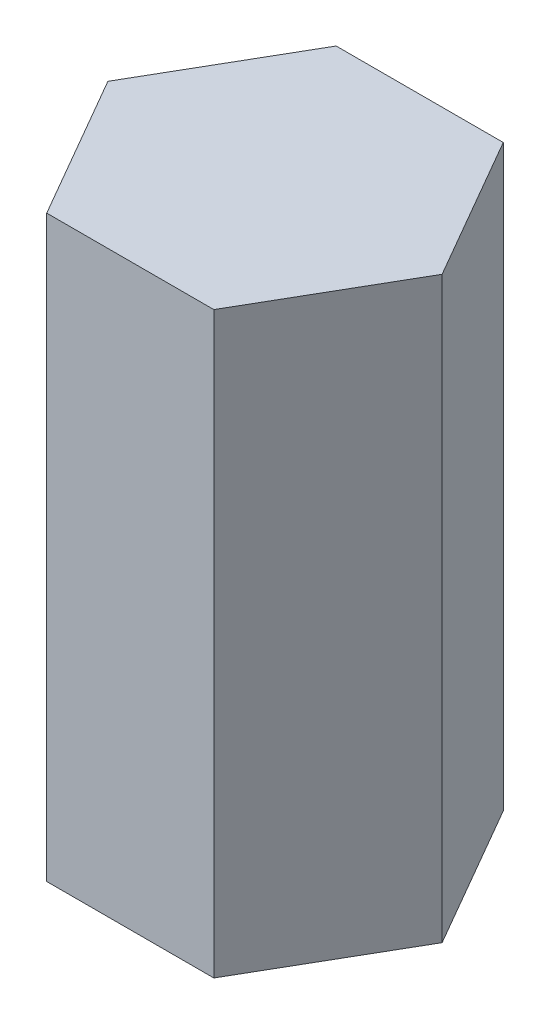
from build123d import *

# Parameters (mm, degrees)
EXTRUDE1_DEPTH = 50


with BuildPart() as part:
    # Sketch1 → Extrude1 (new body)
    with BuildSketch(Plane(origin=(0, 0, 0), x_dir=(1, 0, 0), z_dir=(0, 1, 0))):
        Polygon((-7.216878365, 12.5), (-14.43375673, 0), (-7.216878365, -12.5), (7.216878365, -12.5), (14.43375673, 0), (7.216878365, 12.5), align=None)
    extrude(amount=EXTRUDE1_DEPTH)


solid = part.part
